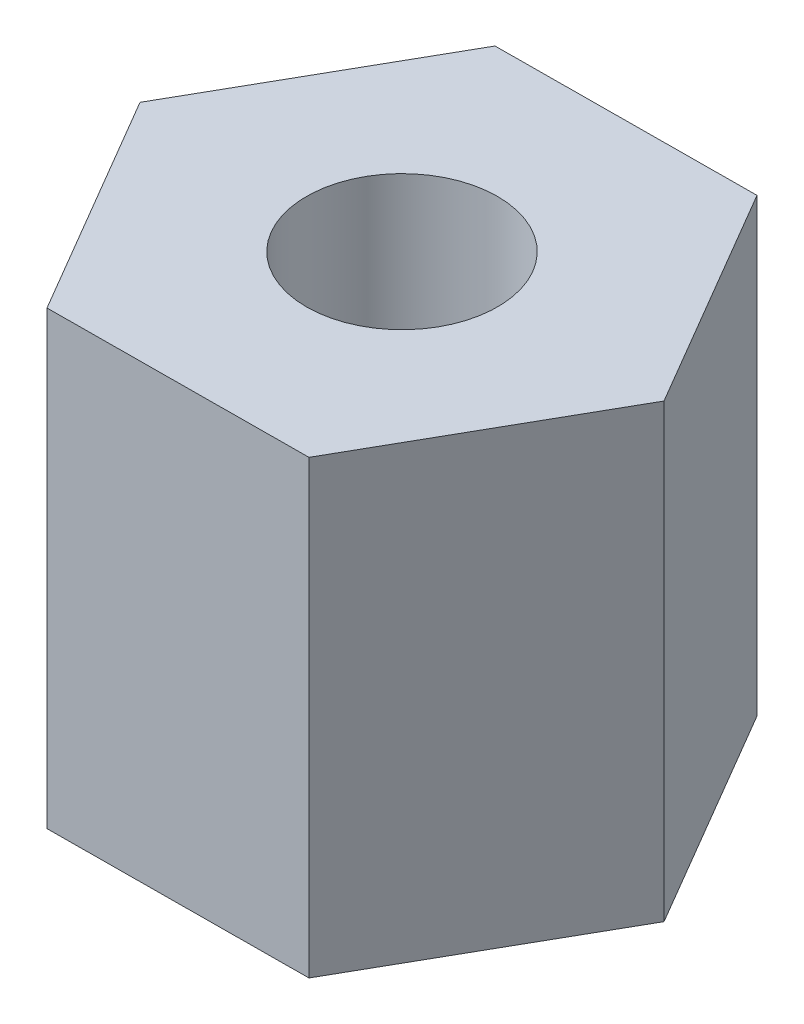
from build123d import *

# Parameters (mm, degrees)
SKETCH2_R           = 2.1209
BOSS_EXTRUDE1_DEPTH = 10


with BuildPart() as part:
    # Sketch2 → Boss-Extrude1 (new body)
    with BuildSketch(Plane(origin=(0, 0, 0), x_dir=(1, 0, 0), z_dir=(0, 1, 0))):
        Polygon((2.918646453, -4.981449209), (5.773384789, 0.036897368), (2.854738336, 5.018346577), (-2.918646453, 4.981449209), (-5.773384789, -0.036897368), (-2.854738336, -5.018346577), align=None)
        with Locations(Location((0, 0, 0), (0, 0, 270))):
            Circle(SKETCH2_R, mode=Mode.SUBTRACT)
    extrude(amount=BOSS_EXTRUDE1_DEPTH)


solid = part.part
